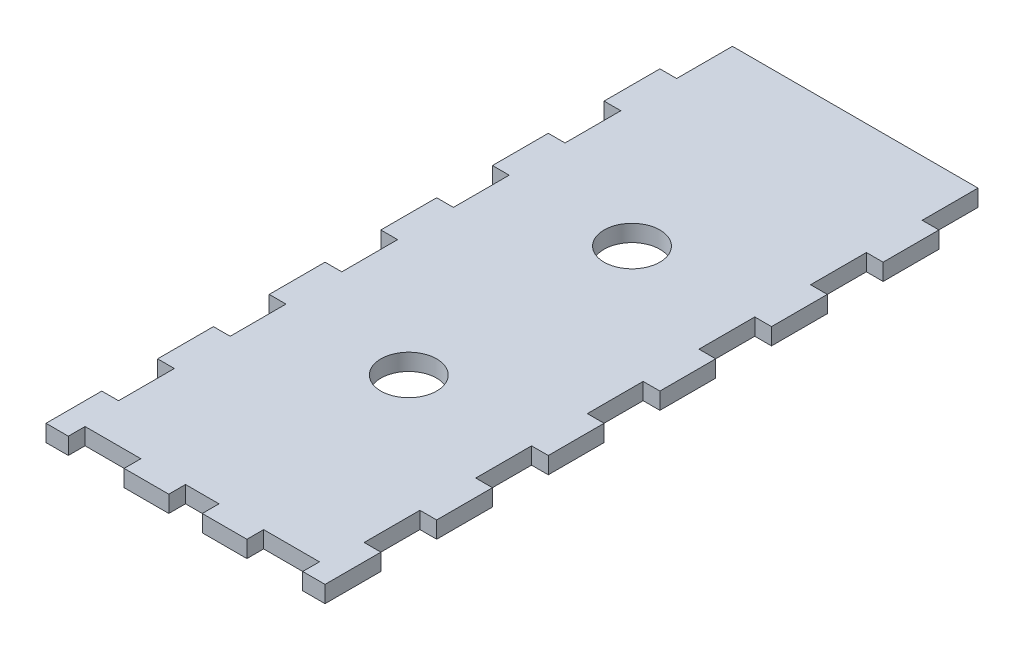
from build123d import *

# Parameters (mm, degrees)
SKETCH1_R           = 5
BOSS_EXTRUDE1_DEPTH = 3


with BuildPart() as part:
    # Sketch1 → Boss-Extrude1 (new body)
    with BuildSketch(Plane(origin=(0, 0, 0), x_dir=(1, 0, 0), z_dir=(0, 1, 0))):
        Polygon((3, 10), (0, 10), (0, 0), (4, 0), (4, 3), (14, 3), (14, 0), (22, 0), (22, 3), (28, 3), (28, 0), (36, 0), (36, 3), (46, 3), (46, 0), (50, 0), (50, 10), (47, 10), (47, 20), (50, 20), (50, 30), (47, 30), (47, 40), (50, 40), (50, 50), (47, 50), (47, 60), (50, 60), (50, 70), (47, 70), (47, 80), (50, 80), (50, 90), (47, 90), (47, 100), (50, 100), (50, 110), (47, 110), (47, 120), (3, 120), (3, 110), (0, 110), (0, 100), (3, 100), (3, 90), (0, 90), (0, 80), (3, 80), (3, 70), (0, 70), (0, 60), (3, 60), (3, 50), (0, 50), (0, 40), (3, 40), (3, 30), (0, 30), (0, 20), (3, 20), align=None)
        with Locations(Location((25, 40, 0), (0, 0, 270))):
            Circle(SKETCH1_R, mode=Mode.SUBTRACT)
        with Locations(Location((25, 80, 0), (0, 0, 270))):
            Circle(SKETCH1_R, mode=Mode.SUBTRACT)
    extrude(amount=BOSS_EXTRUDE1_DEPTH)


solid = part.part
